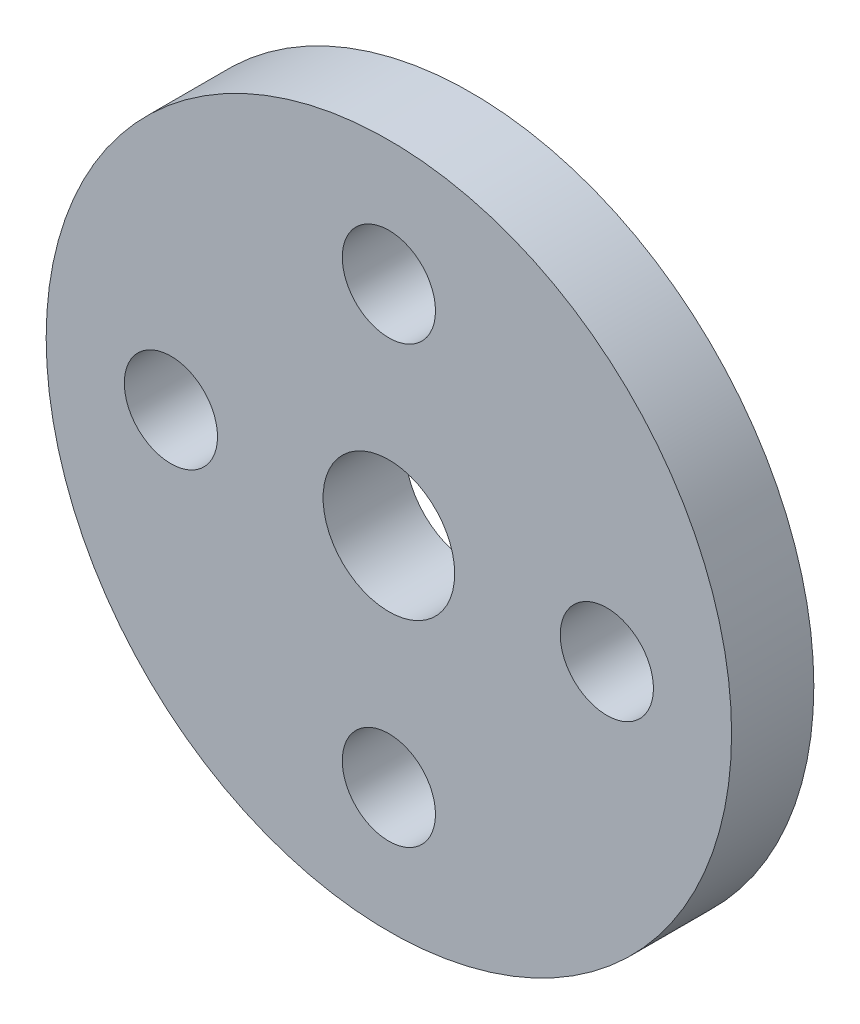
from build123d import *

# Parameters (mm, degrees)
SKETCH_1_R      = 12.5
SKETCH_1_R_2    = 2.4
SKETCH_1_R_3    = 1.7
EXTRUDE_1_DEPTH = 3


with BuildPart() as part:
    # 草圖1 → 伸長1 (new body)
    with BuildSketch(Plane.XY):
        Circle(SKETCH_1_R)
        Circle(SKETCH_1_R_2, mode=Mode.SUBTRACT)
        with Locations((0, 7.95)):
            Circle(SKETCH_1_R_3, mode=Mode.SUBTRACT)
        with Locations((7.95, 0)):
            Circle(SKETCH_1_R_3, mode=Mode.SUBTRACT)
        with Locations((0, -7.95)):
            Circle(SKETCH_1_R_3, mode=Mode.SUBTRACT)
        with Locations((-7.95, 0)):
            Circle(SKETCH_1_R_3, mode=Mode.SUBTRACT)
    extrude(amount=EXTRUDE_1_DEPTH)


solid = part.part
